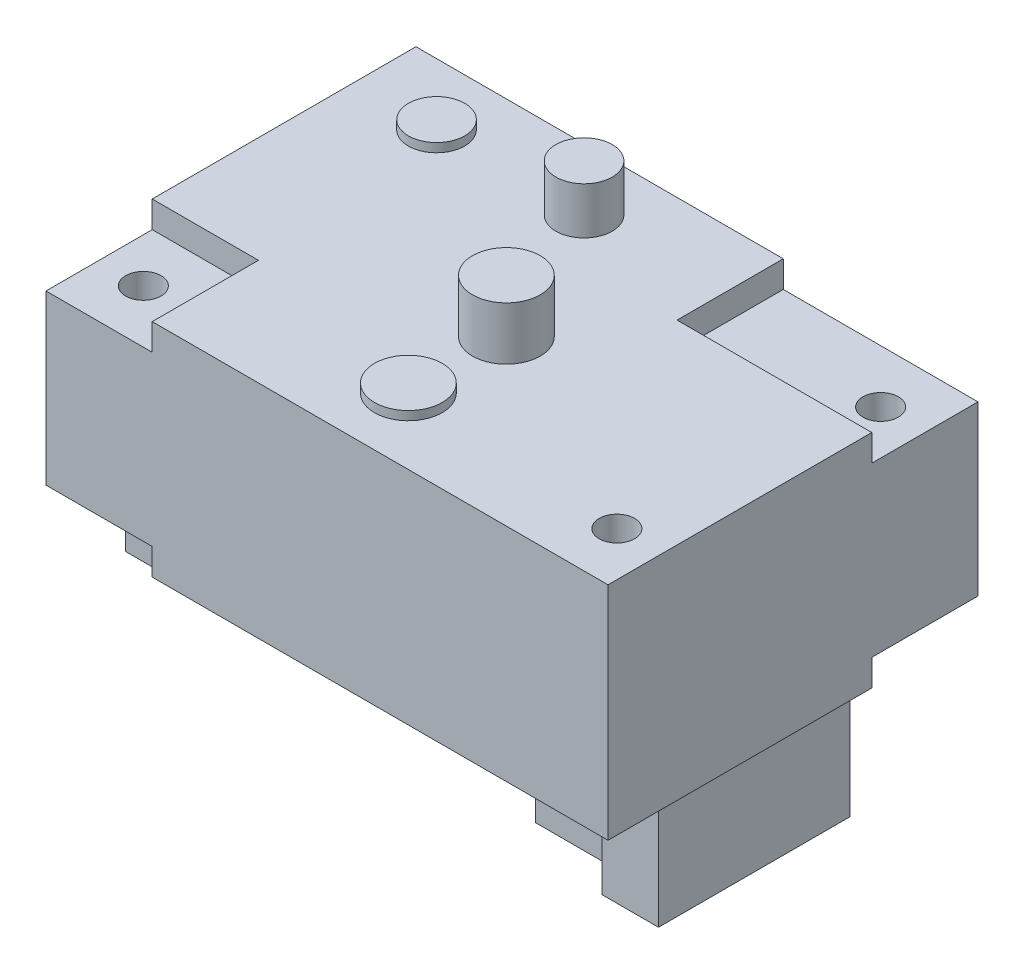
from build123d import *

# Parameters (mm, degrees)
SKETCH_1_W               = 3.183433307
SKETCH_1_H               = 0.999998
SKETCH_2_W               = 12.476289143
SKETCH_2_H               = 38.015688009
EXTRUDE_1_DEPTH          = 24.99995
SKETCH_3_W               = 12.476289143
SKETCH_3_H               = 24.99995
EXTRUDE_2_DEPTH          = 3.784228391
SKETCH_4_W               = 41.7999164
SKETCH_4_H               = 24.99995
EXTRUDE_3_DEPTH          = 51.023583857
SKETCH_6_W               = 21.499957
SKETCH_6_H               = 32.7999344
EXTRUDE_5_DEPTH          = 7.999984
SKETCH_7_W               = 11.999976
SKETCH_7_H               = 2.999994
CUT_EXTRUDE_1_DEPTH      = 8.999982
CUT_EXTRUDE_2_REACH      = 76.808
SKETCH_9_W               = 11.999976
SKETCH_9_H               = 2.999994
SKETCH_10_W              = 6.366689606
SKETCH_10_H              = 21.646744661
EXTRUDE_6_DEPTH          = 12.999974
SKETCH_11_W              = 11.999976
SKETCH_11_H              = 2.999994
CUT_EXTRUDE_3_DEPTH      = 11.999976
SKETCH_12_W              = 11.999976
SKETCH_12_H              = 2.999994
CUT_EXTRUDE_4_DEPTH      = 21.999956
SKETCH_13_W              = 11.999976
SKETCH_13_H              = 2.999994
CUT_EXTRUDE_5_DEPTH      = 11.999976
SKETCH_14_W              = 8.66186009
SKETCH_14_H              = 19.361804907
EXTRUDE_7_DEPTH          = 11.999976
SKETCH_15_W              = 3.82824354
SKETCH_15_H              = 0.999998
SKETCH_16_W              = 3.82824354
SKETCH_16_H              = 6
SKETCH_17_W              = 3.183433307
SKETCH_17_H              = 5.3
HOLE_WIZARD_M3_5_4_D     = 3.999992
HOLE_WIZARD_M3_5_4_DEPTH = 21.999956
HOLE_WIZARD_1_D          = 2.675202715
HOLE_WIZARD_1_DEPTH      = 21.499957
HOLE_WIZARD_M3_5_5_D     = 3.999992
HOLE_WIZARD_M3_5_5_DEPTH = 34.99993


with BuildPart() as part:
    # 草图1 → 旋转1 (revolve)
    with BuildSketch(Plane(origin=(0, 0, 6.967661698), x_dir=(-1, 0, 0), z_dir=(0, 0, -1)), mode=Mode.PRIVATE) as revolve_1_sk:
        with Locations((-10.88457249, 25.499949)):
            Rectangle(SKETCH_1_W, SKETCH_1_H)
    revolve(revolve_1_sk.sketch.rotate(Axis((9.292855836, 24.99995, 6.967661698), (0, 1, 0)), 270), axis=Axis((9.292855836, 24.99995, 6.967661698), (0, 1, 0)))

    # 草图2 → 凸台-拉伸1 (add)
    with BuildSketch(Plane(origin=(0, 24.99995, 0), x_dir=(1, 0, 0), z_dir=(0, 1, 0))):
        with Locations((6.238144572, -22.792072395)):
            Rectangle(SKETCH_2_W, SKETCH_2_H)
    extrude(amount=-EXTRUDE_1_DEPTH)

    # 草图3 → 凸台-拉伸2 (add)
    with BuildSketch(Plane(origin=(0, 0, 3.784228391), x_dir=(-1, 0, 0), z_dir=(0, 0, -1))):
        with Locations((-6.238144572, 12.499975)):
            Rectangle(SKETCH_3_W, SKETCH_3_H)
    extrude(amount=EXTRUDE_2_DEPTH)

    # 草图4 → 凸台-拉伸3 (add)
    with BuildSketch(Plane(origin=(12.476289143, 0, 0), x_dir=(0, 0, -1), z_dir=(1, 0, 0))):
        with Locations((-20.8999582, 12.499975)):
            Rectangle(SKETCH_4_W, SKETCH_4_H)
    extrude(amount=EXTRUDE_3_DEPTH)

    # 草图6 → 凸台-拉伸5 (add)
    with BuildSketch(Plane.XZ):
        with Locations((10.7499785, 16.3999672)):
            Rectangle(SKETCH_6_W, SKETCH_6_H)
    extrude(amount=EXTRUDE_5_DEPTH)

    # 草图7 → 切除-拉伸1 (cut)
    with BuildSketch(Plane.XY.offset(41.7999164)):
        with Locations((5.999988, 1.499997)):
            Rectangle(SKETCH_7_W, SKETCH_7_H)
    extrude(amount=-CUT_EXTRUDE_1_DEPTH, mode=Mode.SUBTRACT)

    # 草图9 → 切除-拉伸2 (cut, up to next)
    with BuildSketch(Plane(origin=(0, 0, 29.7999404), x_dir=(-1, 0, 0), z_dir=(0, 0, -1)), mode=Mode.PRIVATE) as cut_extrude_2_sk1:
        with Locations((-5.999988, 1.499997)):
            Rectangle(SKETCH_9_W, SKETCH_9_H)
    cut_extrude_2_tool1 = extrude(cut_extrude_2_sk1.sketch, amount=-CUT_EXTRUDE_2_REACH, mode=Mode.PRIVATE) & part.part
    add(cut_extrude_2_tool1.solids().sort_by_distance((5.999988, 1.499997, 29.79994))[0], mode=Mode.SUBTRACT)

    # 草图10 → 凸台-拉伸6 (add)
    with BuildSketch(Plane.XZ):
        with Locations((58.681033534, 23.637634731)):
            Rectangle(SKETCH_10_W, SKETCH_10_H)
    extrude(amount=EXTRUDE_6_DEPTH)

    # 草图11 → 切除-拉伸3 (cut)
    with BuildSketch(Plane.XY.offset(41.7999164)):
        with Locations((5.999988, 23.499953)):
            Rectangle(SKETCH_11_W, SKETCH_11_H)
    extrude(amount=-CUT_EXTRUDE_3_DEPTH, mode=Mode.SUBTRACT)

    # 草图12 → 切除-拉伸4 (cut)
    with BuildSketch(Plane(origin=(63.499873, 0, 0), x_dir=(0, 0, -1), z_dir=(1, 0, 0))):
        with Locations((-5.999988, 23.499953)):
            Rectangle(SKETCH_12_W, SKETCH_12_H)
    extrude(amount=-CUT_EXTRUDE_4_DEPTH, mode=Mode.SUBTRACT)

    # 草图13 → 切除-拉伸5 (cut)
    with BuildSketch(Plane(origin=(63.499873, 0, 0), x_dir=(0, 0, -1), z_dir=(1, 0, 0))):
        with Locations((-5.999988, 1.499997)):
            Rectangle(SKETCH_13_W, SKETCH_13_H)
    extrude(amount=-CUT_EXTRUDE_5_DEPTH, mode=Mode.SUBTRACT)

    # 草图14 → 凸台-拉伸7 (add)
    with BuildSketch(Plane.XZ):
        with Locations((50.029008896, 22.492211894)):
            Rectangle(SKETCH_14_W, SKETCH_14_H)
    extrude(amount=EXTRUDE_7_DEPTH)

    # 草图15 → 旋转2 (revolve)
    with BuildSketch(Plane(origin=(0, 0, 34.32537348), x_dir=(-1, 0, 0), z_dir=(0, 0, -1)), mode=Mode.PRIVATE) as revolve_2_sk:
        with Locations((-35.382002405, 25.499949)):
            Rectangle(SKETCH_15_W, SKETCH_15_H)
    revolve(revolve_2_sk.sketch.rotate(Axis((33.467880635, 24.99995, 34.32537348), (0, 1, 0)), 270), axis=Axis((33.467880635, 24.99995, 34.32537348), (0, 1, 0)))

    # 草图16 → 旋转3 (revolve)
    with BuildSketch(Plane(origin=(0, 0, 23.254177941), x_dir=(-1, 0, 0), z_dir=(0, 0, -1)), mode=Mode.PRIVATE) as revolve_3_sk:
        with Locations((-35.382002405, 27.99995)):
            Rectangle(SKETCH_16_W, SKETCH_16_H)
    revolve(revolve_3_sk.sketch.rotate(Axis((33.467880635, 24.99995, 23.254177941), (0, 1, 0)), 270), axis=Axis((33.467880635, 24.99995, 23.254177941), (0, 1, 0)))

    # 草图17 → 旋转4 (revolve)
    with BuildSketch(Plane(origin=(0, 0, 6.967661698), x_dir=(-1, 0, 0), z_dir=(0, 0, -1)), mode=Mode.PRIVATE) as revolve_4_sk:
        with Locations((-27.552434059, 27.64995)):
            Rectangle(SKETCH_17_W, SKETCH_17_H)
    revolve(revolve_4_sk.sketch.rotate(Axis((25.960717405, 24.99995, 6.967661698), (0, 1, 0)), 270), axis=Axis((25.960717405, 24.99995, 6.967661698), (0, 1, 0)))

    # M3.5 间隙孔4
    with Locations(Plane(origin=(0, 24.99995, 0), x_dir=(1, 0, 0), z_dir=(0, 1, 0))):
        with Locations((58.499883, -35.7999284)):
            Hole(HOLE_WIZARD_M3_5_4_D / 2, depth=HOLE_WIZARD_M3_5_4_DEPTH)

    # 孔1
    with Locations(Plane(origin=(21.499957, 0, 0), x_dir=(0, 0, -1), z_dir=(1, 0, 0))):
        with Locations((-16.500963355, -3.875126559), (-21.645583961, -3.875126559), (-26.069957682, -3.875126559), (-30.391438991, -3.875126559), (-11.870804809, -3.875126559), (-7.858000737, -3.875126559), (-3.227842192, -3.875126559)):
            Hole(HOLE_WIZARD_1_D / 2, depth=HOLE_WIZARD_1_DEPTH)

    # M3.5 间隙孔5
    with Locations(Plane(origin=(0, 21.999956, 0), x_dir=(1, 0, 0), z_dir=(0, 1, 0))):
        with Locations((58.499883, -5.999988), (4.99999, -35.7999284)):
            Hole(HOLE_WIZARD_M3_5_5_D / 2, depth=HOLE_WIZARD_M3_5_5_DEPTH)


solid = part.part
